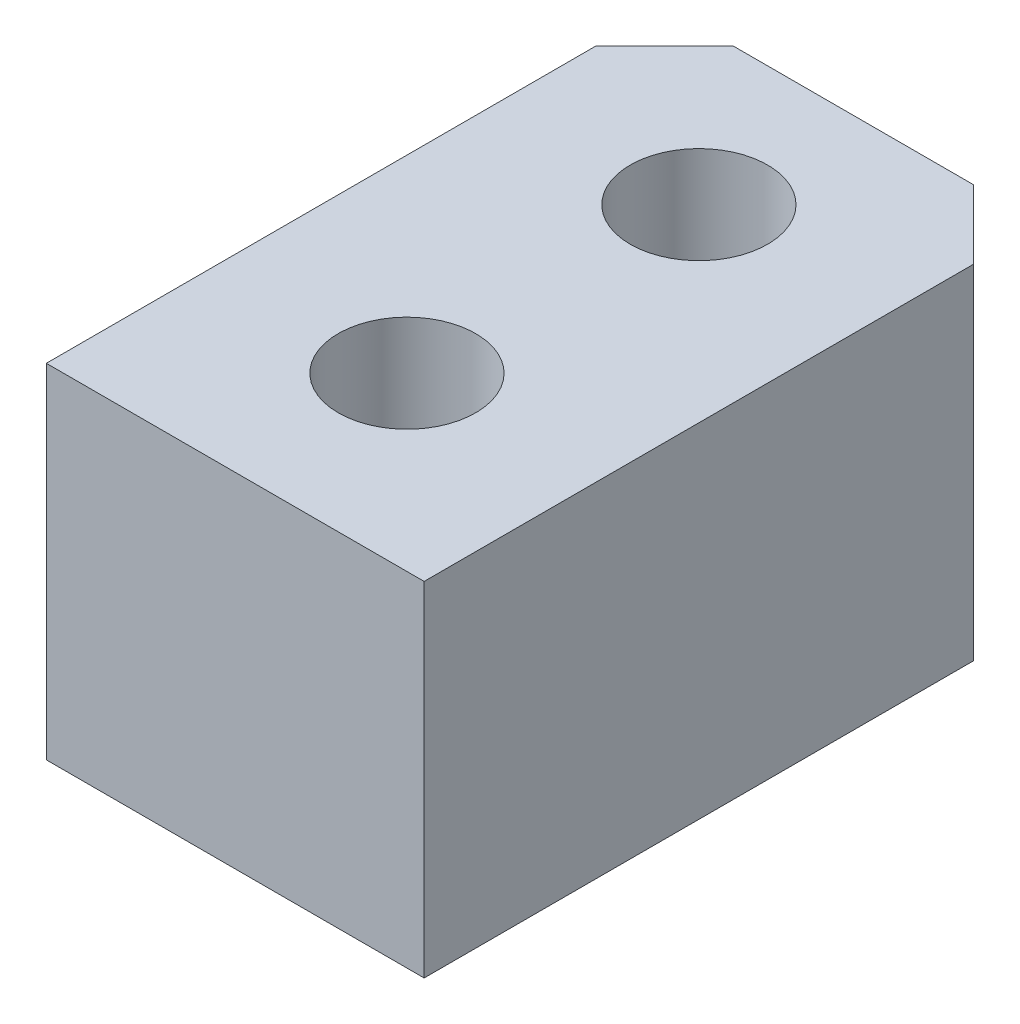
from build123d import *

# Parameters (mm, degrees)
SKETCH_1_W      = 22
SKETCH_1_H      = 36
SKETCH_1_R      = 4
EXTRUDE_1_DEPTH = 20
CHAMFER_1_SIZE  = 4


with BuildPart() as part:
    # 草图1 → 凸台-拉伸1 (new body)
    with BuildSketch(Plane(origin=(0, 0, 0), x_dir=(1, 0, 0), z_dir=(0, 1, 0))):
        with Locations((0.115789474, 0.4)):
            Rectangle(SKETCH_1_W, SKETCH_1_H)
        with Locations(Location((0.115789474, -7.6, 0), (0, 0, 270))):
            Circle(SKETCH_1_R, mode=Mode.SUBTRACT)
        with Locations(Location((0.115789474, 9.4, 0), (0, 0, 270))):
            Circle(SKETCH_1_R, mode=Mode.SUBTRACT)
    extrude(amount=EXTRUDE_1_DEPTH)

    # 倒角1
    chamfer_1_edges = [part.edges().sort_by_distance(p)[0] for p in [
        (-10.884210526, 10, -18.4),
        (11.115789474, 10, -18.4),
    ]]
    chamfer(chamfer_1_edges, length=CHAMFER_1_SIZE)


solid = part.part
